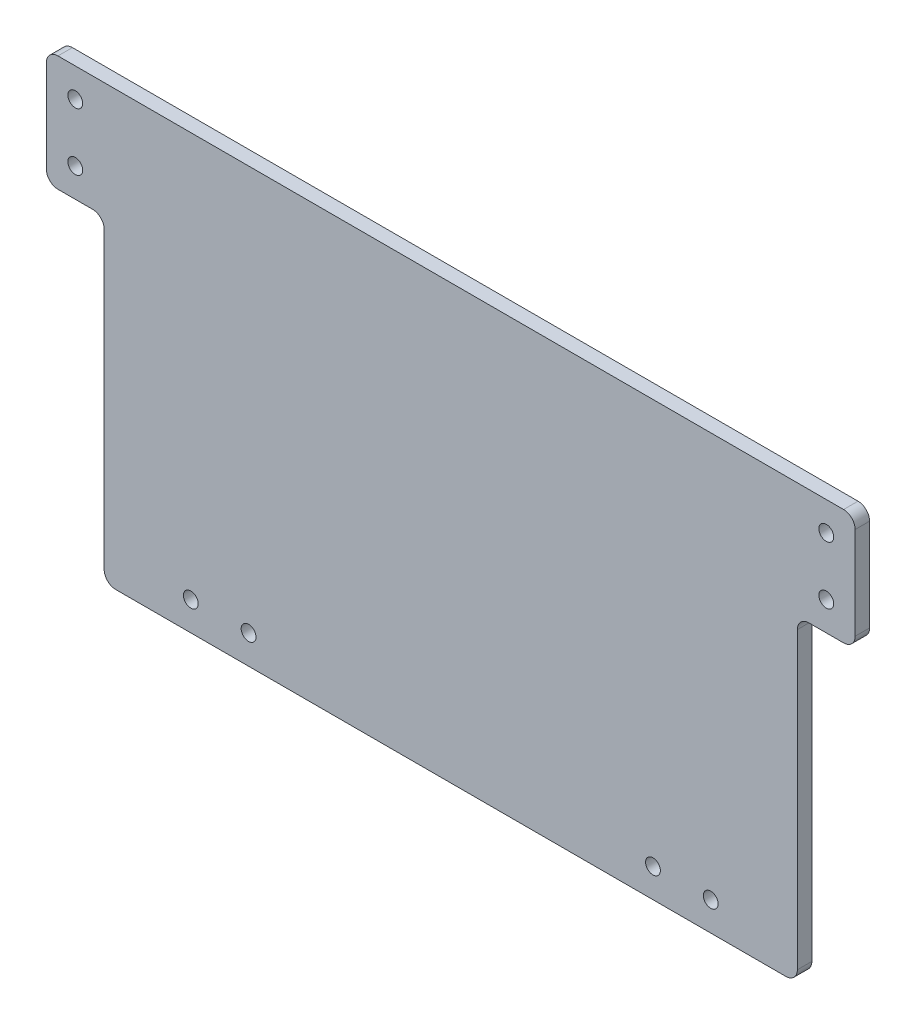
from build123d import *

# Parameters (mm, degrees)
SKETCH1_W           = 304.8
SKETCH1_H           = 190.5
BOSS_EXTRUDE1_DEPTH = 6.35
SKETCH2_R           = 3.2639
CUT_EXTRUDE1_DEPTH  = 180.829488683
SKETCH3_W           = 25.4
SKETCH3_H           = 50.8
SKETCH3_R           = 3.2639
BOSS_EXTRUDE2_DEPTH = 6.35
FILLET1_R           = 5.08


with BuildPart() as part:
    # Sketch1 → Boss-Extrude1 (new body)
    with BuildSketch(Plane.XY):
        Rectangle(SKETCH1_W, SKETCH1_H)
    extrude(amount=BOSS_EXTRUDE1_DEPTH)

    # Sketch2 → Cut-Extrude1 (cut, through all)
    with BuildSketch(Plane.XY.offset(6.35)):
        with Locations((-114.3, -82.55)):
            Circle(SKETCH2_R)
        with Locations((-88.9, -82.55)):
            Circle(SKETCH2_R)
        with Locations((88.9, -82.55)):
            Circle(SKETCH2_R)
        with Locations((114.3, -82.55)):
            Circle(SKETCH2_R)
    extrude(amount=-CUT_EXTRUDE1_DEPTH, mode=Mode.SUBTRACT)

    # Sketch3 → Boss-Extrude2 (add)
    with BuildSketch(Plane.XY):
        with Locations((-165.1, 69.85)):
            Rectangle(SKETCH3_W, SKETCH3_H)
        with Locations((-165.1, 82.55)):
            Circle(SKETCH3_R, mode=Mode.SUBTRACT)
        with Locations((-165.1, 57.15)):
            Circle(SKETCH3_R, mode=Mode.SUBTRACT)
    boss_extrude2 = extrude(amount=BOSS_EXTRUDE2_DEPTH)

    # Mirror1: Boss-Extrude2 across plane
    add(boss_extrude2.mirror(Plane(origin=(0, 0, 0), x_dir=(0, 0, 1), z_dir=(1, 0, 0))))

    # Fillet1
    fillet1_edges = [part.edges().sort_by_distance(p)[0] for p in [
        (-177.8, 44.45, 3.175),
        (-177.8, 95.25, 3.175),
        (-152.4, 44.45, 3.175),
        (152.4, 44.45, 3.175),
        (177.8, 44.45, 3.175),
        (177.8, 95.25, 3.175),
        (152.4, -95.25, 3.175),
        (-152.4, -95.25, 3.175),
    ]]
    fillet(fillet1_edges, radius=FILLET1_R)


solid = part.part
